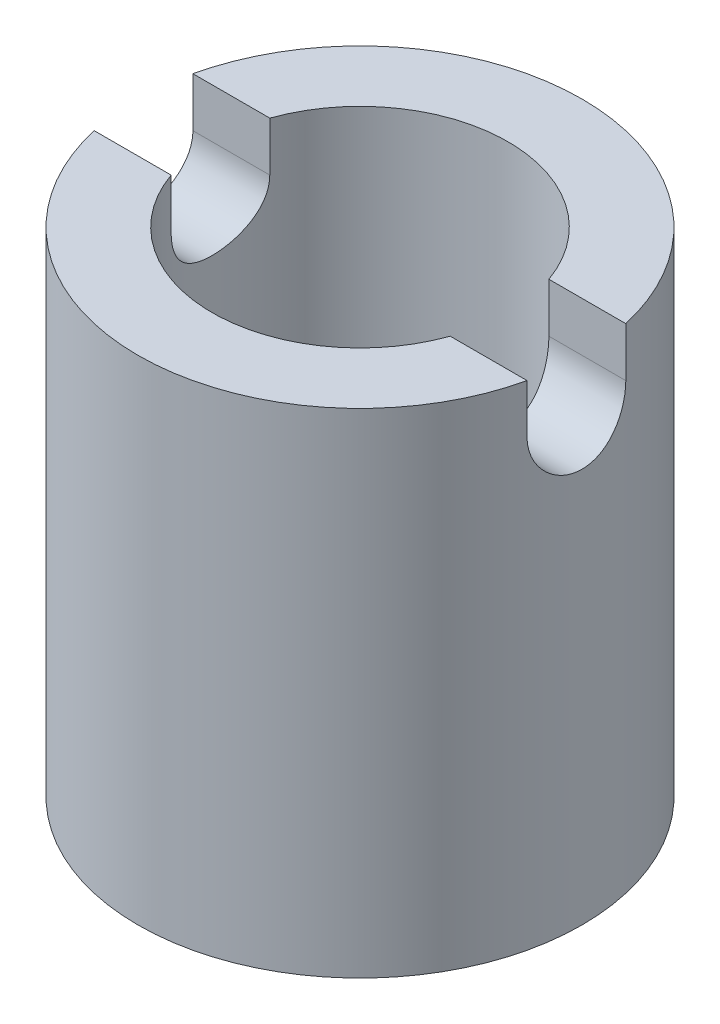
from build123d import *
from build123d.topology import SkipClean

# Parameters (mm, degrees)
SKETCH_1_R               = 4.5
SKETCH_1_R_2             = 3
EXTRUDE_1_DEPTH          = 9
CUT_EXTRUDE_3_DEPTH      = 12.022703843
CUT_EXTRUDE_3_DEPTH_BACK = 12.022703843
SKETCH_2_R               = 1
EXTRUDE_2_DEPTH          = 1


with BuildPart() as part:
    # ｽｹｯﾁ1 → ﾎﾞｽ - 押し出し1 (new body)
    with BuildSketch(Plane(origin=(0, 0, 0), x_dir=(1, 0, 0), z_dir=(0, 1, 0))):
        with Locations(Location((0, 0, 0), (0, 0, 270))):
            Circle(SKETCH_1_R)
        with Locations(Location((0, 0, 0), (0, 0, 270))):
            Circle(SKETCH_1_R_2, mode=Mode.SUBTRACT)
    extrude(amount=EXTRUDE_1_DEPTH)

    # ｽｹｯﾁ2 → ｶｯﾄ - 押し出し3 (cut, two sides: drawn at the far end of the back side and taken through both)
    with BuildSketch(Plane(origin=(0, 0, 0), x_dir=(0, 0, -1), z_dir=(1, 0, 0)).offset(-CUT_EXTRUDE_3_DEPTH_BACK)):
        with Locations((0, 9)):
            Circle(SKETCH_2_R)
    extrude(amount=CUT_EXTRUDE_3_DEPTH + CUT_EXTRUDE_3_DEPTH_BACK, mode=Mode.SUBTRACT)

    # ｽｹｯﾁ3 → ﾎﾞｽ - 押し出し2 (add)
    with SkipClean():  # the faces are left unmerged after this step: merging them gives an invalid solid
        with BuildSketch(Plane(origin=(0, 9, 0), x_dir=(1, 0, 0), z_dir=(0, 1, 0))):
            with BuildLine():
                Line((-2.828427125, -1), (-4.387482194, -1))
                ThreePointArc((-4.387482194, -1), (0, -4.5), (4.387482194, -1))
                Line((4.387482194, -1), (2.828427125, -1))
                ThreePointArc((2.828427125, -1), (0, -3), (-2.828427125, -1))
            make_face()
            with BuildLine():
                Line((2.828427125, 1), (4.387482194, 1))
                ThreePointArc((4.387482194, 1), (0, 4.5), (-4.387482194, 1))
                Line((-4.387482194, 1), (-2.828427125, 1))
                ThreePointArc((-2.828427125, 1), (0, 3), (2.828427125, 1))
            make_face()
        extrude(amount=EXTRUDE_2_DEPTH)


solid = part.part
